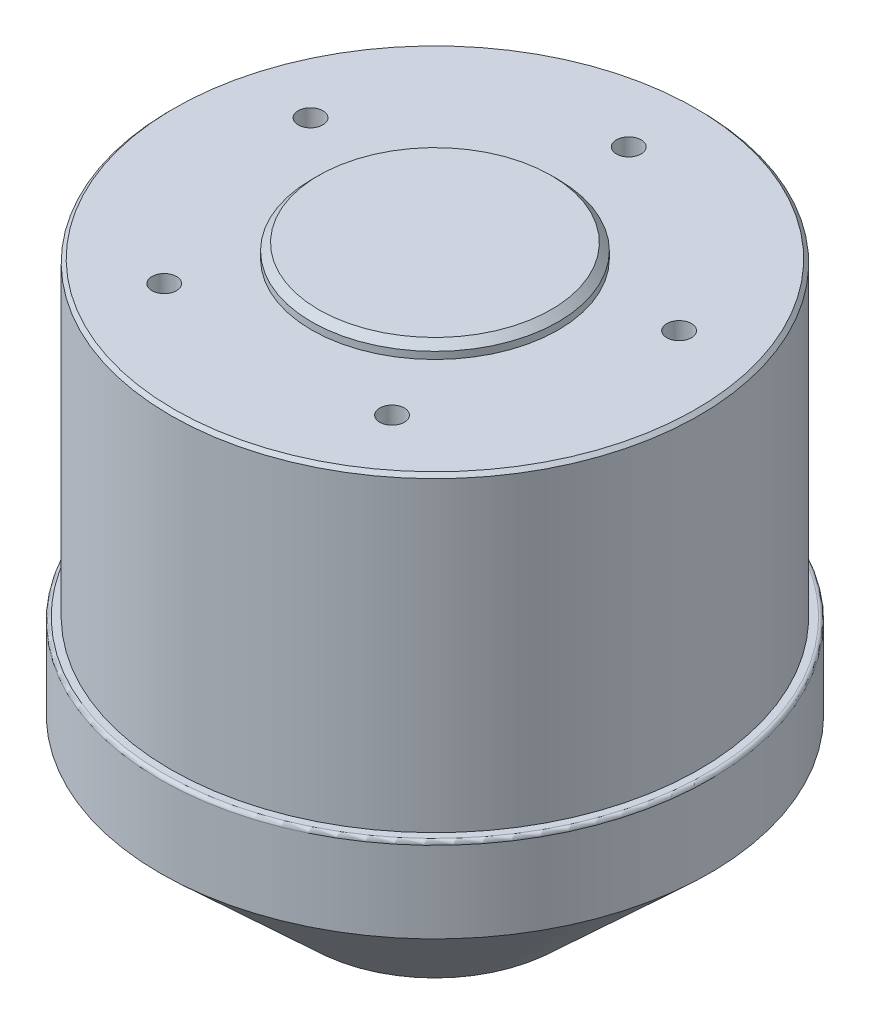
from build123d import *

# Parameters (mm, degrees)
SKETCH1_R           = 37.5
SKETCH1_R_2         = 17.5
BOSS_EXTRUDE1_DEPTH = 76
SKETCH1_3_R         = 17.5
BOSS_EXTRUDE2_DEPTH = 78
SKETCH1_4_R         = 39
SKETCH1_4_R_2       = 37.5
BOSS_EXTRUDE3_DEPTH = 32
SKETCH2_R           = 1.75
CUT_EXTRUDE1_DEPTH  = 7
FILLET1_R           = 0.5
CHAMFER1_SIZE       = 0.5
CHAMFER2_SIZE       = 21.5
CHAMFER2_SIZE2      = 20
CHAMFER3_SIZE       = 1
SKETCH4_R           = 4
CUT_EXTRUDE2_DEPTH  = 68


with BuildPart() as part:
    # Sketch1 → Boss-Extrude1 (new body)
    with BuildSketch(Plane(origin=(0, 0, 0), x_dir=(1, 0, 0), z_dir=(0, 1, 0))):
        with Locations(Location((0, 0, 0), (0, 0, 270))):
            Circle(SKETCH1_R)
        with Locations(Location((0, 0, 0), (0, 0, 270))):
            Circle(SKETCH1_R_2, mode=Mode.SUBTRACT)
    extrude(amount=BOSS_EXTRUDE1_DEPTH)

    # Sketch1<3> → Boss-Extrude2 (add)
    with BuildSketch(Plane(origin=(0, 0, 0), x_dir=(1, 0, 0), z_dir=(0, 1, 0))):
        with Locations(Location((0, 0, 0), (0, 0, 270))):
            Circle(SKETCH1_3_R)
    extrude(amount=BOSS_EXTRUDE2_DEPTH)

    # Sketch1<4> → Boss-Extrude3 (add)
    with BuildSketch(Plane(origin=(0, 0, 0), x_dir=(1, 0, 0), z_dir=(0, 1, 0))):
        with Locations(Location((0, 0, 0), (0, 0, 270))):
            Circle(SKETCH1_4_R)
        with Locations(Location((0, 0, 0), (0, 0, 270))):
            Circle(SKETCH1_4_R_2, mode=Mode.SUBTRACT)
    extrude(amount=BOSS_EXTRUDE3_DEPTH)

    # Sketch2 → Cut-Extrude1 (cut)
    with BuildSketch(Plane(origin=(0, 76, 0), x_dir=(1, 0, 0), z_dir=(0, 1, 0))):
        with Locations(Location((0, 27.5, 0), (0, 0, 270))):
            Circle(SKETCH2_R)
        with Locations(Location((26.154054198, 8.497967345, 0), (0, 0, 270))):
            Circle(SKETCH2_R)
        with Locations(Location((16.164094438, -22.247967345, 0), (0, 0, 270))):
            Circle(SKETCH2_R)
        with Locations(Location((-16.164094438, -22.247967345, 0), (0, 0, 270))):
            Circle(SKETCH2_R)
        with Locations(Location((-26.154054198, 8.497967345, 0), (0, 0, 270))):
            Circle(SKETCH2_R)
    extrude(amount=-CUT_EXTRUDE1_DEPTH, mode=Mode.SUBTRACT)

    # Fillet1
    fillet1_edges = [part.edges().sort_by_distance(p)[0] for p in [
        (0, 32, -39),
    ]]
    fillet(fillet1_edges, radius=FILLET1_R)

    # Chamfer1
    chamfer1_edges = [part.edges().sort_by_distance(p)[0] for p in [
        (0, 76, -37.5),
    ]]
    chamfer(chamfer1_edges, length=CHAMFER1_SIZE)

    # Chamfer2
    chamfer2_edges = [part.edges().sort_by_distance(p)[0] for p in [
        (0, 0, -39),
    ]]
    chamfer2_side = [part.faces().sort_by_distance(p)[0] for p in [
        (0, 0, 0),
    ]]
    chamfer(chamfer2_edges, length=CHAMFER2_SIZE, length2=CHAMFER2_SIZE2, reference=chamfer2_side[0])

    # Chamfer3
    chamfer3_edges = [part.edges().sort_by_distance(p)[0] for p in [
        (0, 78, -17.5),
    ]]
    chamfer(chamfer3_edges, length=CHAMFER3_SIZE)

    # Sketch4 → Cut-Extrude2 (cut)
    with BuildSketch(Plane.XZ):
        with Locations(Location((0, 0, 0), (0, 0, 270))):
            Circle(SKETCH4_R)
    extrude(amount=-CUT_EXTRUDE2_DEPTH, mode=Mode.SUBTRACT)


solid = part.part
